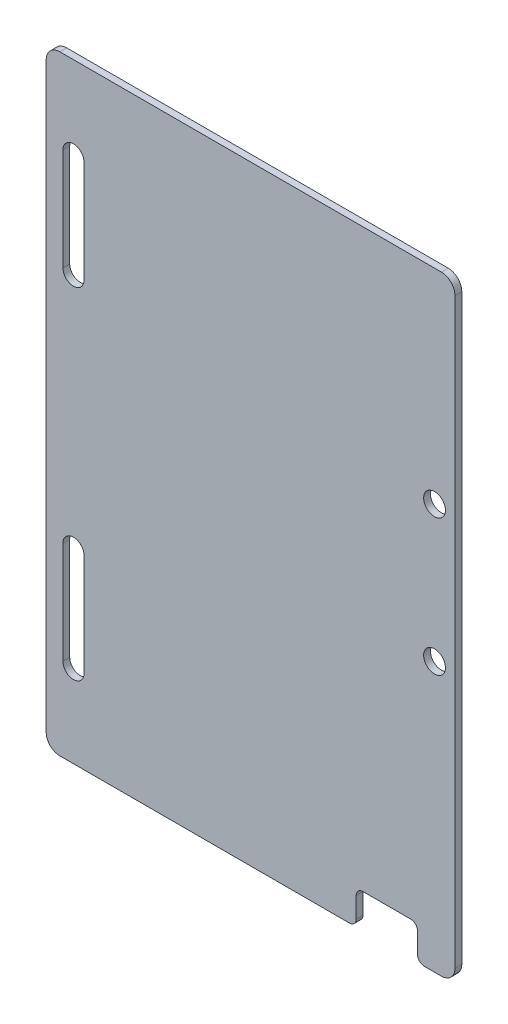
from build123d import *

# Parameters (mm, degrees)
SKETCH_1_W          = 60
SKETCH_1_H          = 89.5
SKETCH_1_R          = 1.6
EXTRUDE_1_DEPTH     = 1
CUT_EXTRUDE_1_DEPTH = 10
FILLET_1_R          = 2
SKETCH_3_W          = 9
SKETCH_3_H          = 10
CUT_EXTRUDE_2_DEPTH = 10
FILLET_2_R          = 1


with BuildPart() as part:
    # 草图1 → 凸台-拉伸1 (new body)
    with BuildSketch(Plane.XY):
        Rectangle(SKETCH_1_W, SKETCH_1_H)
        with Locations((27, 14.75)):
            Circle(SKETCH_1_R, mode=Mode.SUBTRACT)
        with Locations((27, -5.25)):
            Circle(SKETCH_1_R, mode=Mode.SUBTRACT)
    extrude(amount=EXTRUDE_1_DEPTH)

    # 草图2 → 切除-拉伸1 (cut)
    with BuildSketch(Plane.XY.offset(1)):
        with BuildLine():
            Line((-24.45, 32.5), (-24.45, 17.5))
            ThreePointArc((-24.45, 17.5), (-26, 15.95), (-27.55, 17.5))
            Line((-27.55, 17.5), (-27.55, 32.5))
            ThreePointArc((-27.55, 32.5), (-26, 34.05), (-24.45, 32.5))
        make_face()
        with BuildLine():
            Line((-24.45, -17.5), (-24.45, -32.5))
            ThreePointArc((-24.45, -32.5), (-26, -34.05), (-27.55, -32.5))
            Line((-27.55, -32.5), (-27.55, -17.5))
            ThreePointArc((-27.55, -17.5), (-26, -15.95), (-24.45, -17.5))
        make_face()
    extrude(amount=-CUT_EXTRUDE_1_DEPTH, mode=Mode.SUBTRACT)

    # 圆角1
    fillet_1_edges = [part.edges().sort_by_distance(p)[0] for p in [
        (30, -44.75, 0.5),
        (-30, -44.75, 0.5),
        (-30, 44.75, 0.5),
        (30, 44.75, 0.5),
    ]]
    fillet(fillet_1_edges, radius=FILLET_1_R)

    # 草图3 → 切除-拉伸2 (cut)
    with BuildSketch(Plane(origin=(0, 0, 0), x_dir=(-1, 0, 0), z_dir=(0, 0, -1))):
        with Locations((-20, -44.75)):
            Rectangle(SKETCH_3_W, SKETCH_3_H)
    extrude(amount=-CUT_EXTRUDE_2_DEPTH, mode=Mode.SUBTRACT)

    # 圆角2
    fillet_2_edges = [part.edges().sort_by_distance(p)[0] for p in [
        (24.5, -44.75, 0.5),
        (15.5, -44.75, 0.5),
        (24.5, -39.75, 0.5),
        (15.5, -39.75, 0.5),
    ]]
    fillet(fillet_2_edges, radius=FILLET_2_R)


solid = part.part
